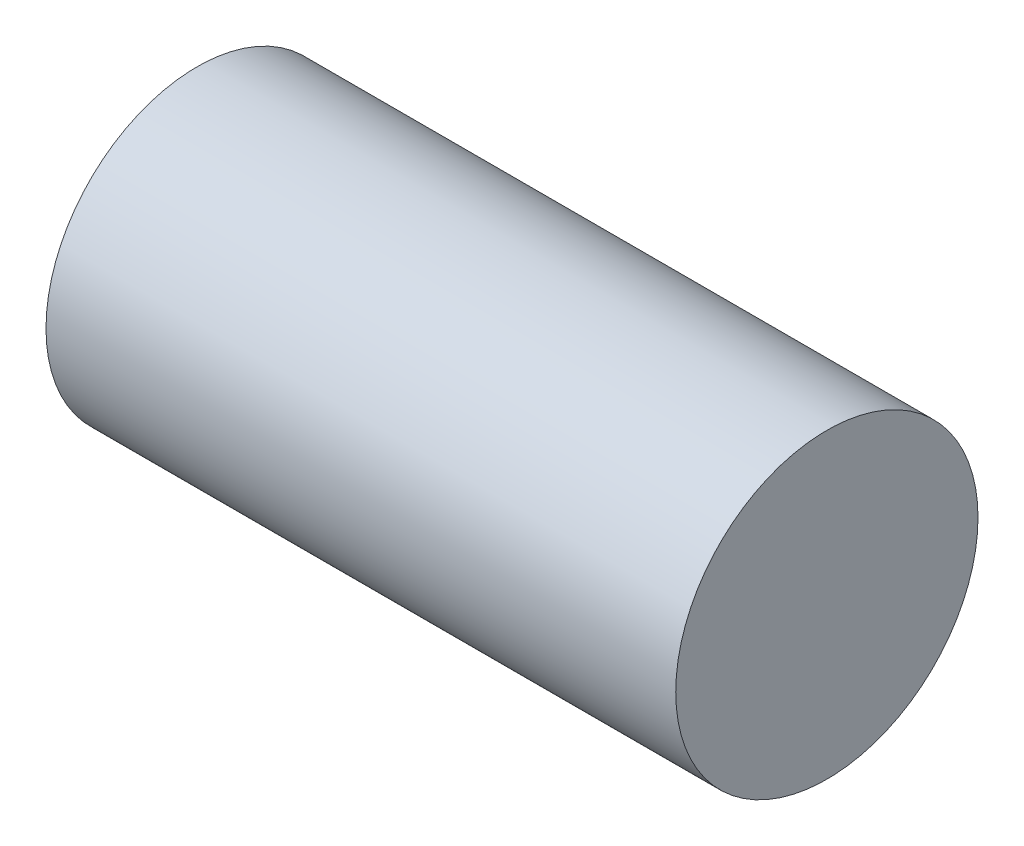
from build123d import *

# Parameters (mm, degrees)
SKETCH1_W = 10
SKETCH1_H = 2.4


with BuildPart() as part:
    # Sketch1 → Revolve-Thin1 (revolve)
    with BuildSketch(Plane.XY, mode=Mode.PRIVATE) as revolve_thin1_sk:
        with Locations((5, 1.2)):
            Rectangle(SKETCH1_W, SKETCH1_H)
    revolve(revolve_thin1_sk.sketch.rotate(Axis((0, 0, 0), (1, 0, 0)), 90), axis=Axis((0, 0, 0), (1, 0, 0)))


solid = part.part
